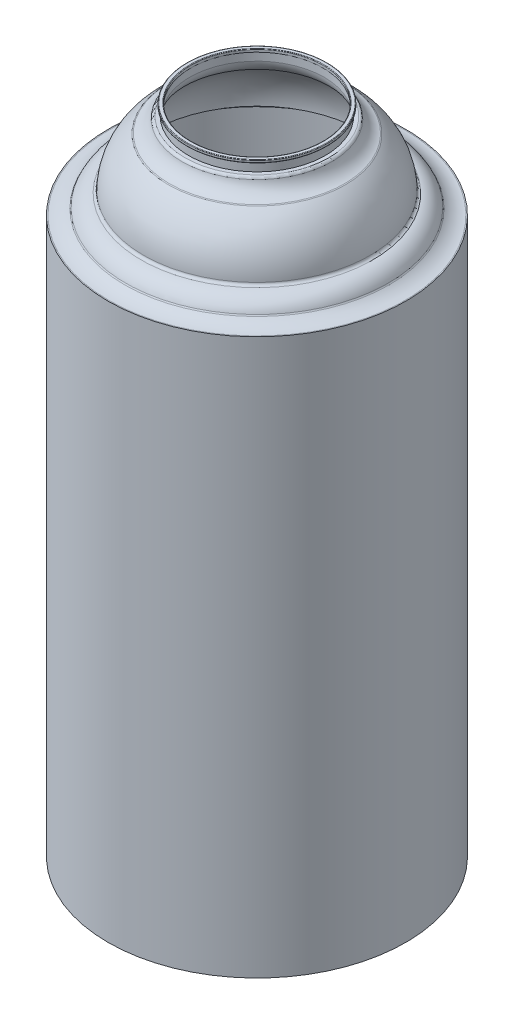
from build123d import *

# Parameters (mm, degrees)
SKETCH1_R           = 66.04
SKETCH1_R_2         = 64.4525
BOSS_EXTRUDE1_DEPTH = 246.38
FILLET3_R           = 1.27
SKETCH11_R          = 30.353
SKETCH11_R_2        = 29.845
BOSS_EXTRUDE2_DEPTH = 3.81
SKETCH12_R          = 31.058986448
SKETCH12_R_2        = 29.337
BOSS_EXTRUDE3_DEPTH = 1.27
FILLET4_R           = 0.254


with BuildPart() as part:
    # Sketch1 → Boss-Extrude1 (new body)
    with BuildSketch(Plane(origin=(0, 0, 0), x_dir=(1, 0, 0), z_dir=(0, 1, 0))):
        with Locations(Location((0, 0, 0), (0, 0, 270))):
            Circle(SKETCH1_R)
        with Locations(Location((0, 0, 0), (0, 0, 270))):
            Circle(SKETCH1_R_2, mode=Mode.SUBTRACT)
    extrude(amount=BOSS_EXTRUDE1_DEPTH)

    # Sketch4 → Revolve5 (revolve)
    with BuildSketch(Plane.XY, mode=Mode.PRIVATE) as revolve5_sk:
        with BuildLine():
            ThreePointArc((-50.313730209, 254.962138497), (-55.29308505, 253.369930369), (-58.424842289, 249.184097363))
            ThreePointArc((-58.424842289, 249.184097363), (-61.96758374, 247.062823084), (-66.04, 246.38))
            Line((-66.04, 246.38), (0, 246.38))
            Line((0, 246.38), (0, 284.48))
            Line((0, 284.48), (-33.02, 284.48))
            ThreePointArc((-33.02, 284.48), (-34.99100046, 280.215897021), (-39.01155126, 277.786372726))
            ThreePointArc((-39.01155126, 277.786372726), (-47.333429049, 267.696785304), (-50.313730209, 254.962138497))
        make_face()
    revolve(revolve5_sk.sketch.rotate(Axis((0, 246.38, 0), (0, 1, 0)), 270), axis=Axis((0, 246.38, 0), (0, 1, 0)))

    # Fillet3
    fillet3_edges = [part.edges().sort_by_distance(p)[0] for p in [
        (0, 246.38, 65.582447768),
        (0, 254.962138497, 50.313730209),
        (0, 249.184097363, 58.424842289),
        (0, 284.48, 33.02),
        (0, 277.786372726, 39.01155126),
    ]]
    fillet(fillet3_edges, radius=FILLET3_R)

    # Sketch7 → Revolve8 (revolve)
    with BuildSketch(Plane(origin=(0, 0, 0), x_dir=(0, 0, -1), z_dir=(1, 0, 0))):
        with BuildLine():
            ThreePointArc((-66.04, 3.175), (-34.293967325, 16.978033309), (0, 21.695884959))
            Line((0, 21.695884959), (0, 18.520884959))
            ThreePointArc((0, 18.520884959), (-34.293967325, 13.803033309), (-66.04, 0))
            Line((-66.04, 0), (-66.04, 3.175))
        make_face()
    revolve(axis=Axis((0, 0, 0), (0, 1, 0)))

    # Sketch10 → Cut-Revolve1 (revolve, cut)
    with BuildSketch(Plane.XY, mode=Mode.PRIVATE) as cut_revolve1_sk:
        with BuildLine():
            Line((-60.092086221, 246.38), (0, 246.38))
            Line((0, 246.38), (0, 284.48))
            Line((0, 284.48), (-29.845, 284.48))
            ThreePointArc((-29.845, 284.48), (-31.81600046, 280.215897021), (-35.83655126, 277.786372726))
            ThreePointArc((-35.83655126, 277.786372726), (-44.158429049, 267.696785304), (-47.138730209, 254.962138497))
            ThreePointArc((-47.138730209, 254.962138497), (-52.11808505, 253.369930369), (-55.249842289, 249.184097363))
            ThreePointArc((-55.249842289, 249.184097363), (-57.49176142, 247.472593008), (-60.092086221, 246.38))
        make_face()
    revolve(cut_revolve1_sk.sketch.rotate(Axis((0, 246.38, 0), (0, 1, 0)), 270), axis=Axis((0, 246.38, 0), (0, 1, 0)), mode=Mode.SUBTRACT)

    # Sketch11 → Boss-Extrude2 (add)
    with BuildSketch(Plane(origin=(0, 284.48, 0), x_dir=(1, 0, 0), z_dir=(0, 1, 0))):
        with Locations(Location((0, 0, 0), (0, 0, 90))):
            Circle(SKETCH11_R)
        with Locations(Location((0, 0, 0), (0, 0, 90))):
            Circle(SKETCH11_R_2, mode=Mode.SUBTRACT)
    extrude(amount=BOSS_EXTRUDE2_DEPTH)

    # Sketch12 → Boss-Extrude3 (add)
    with BuildSketch(Plane(origin=(0, 288.29, 0), x_dir=(1, 0, 0), z_dir=(0, 1, 0))):
        with Locations(Location((0, 0, 0), (0, 0, 270))):
            Circle(SKETCH12_R)
        with Locations(Location((0, 0, 0), (0, 0, 270))):
            Circle(SKETCH12_R_2, mode=Mode.SUBTRACT)
    extrude(amount=BOSS_EXTRUDE3_DEPTH)

    # Fillet4
    fillet4_edges = [part.edges().sort_by_distance(p)[0] for p in [
        (0, 289.56, -31.058986448),
        (0, 288.29, -31.058986448),
        (0, 289.56, -29.337),
    ]]
    fillet(fillet4_edges, radius=FILLET4_R)


solid = part.part
